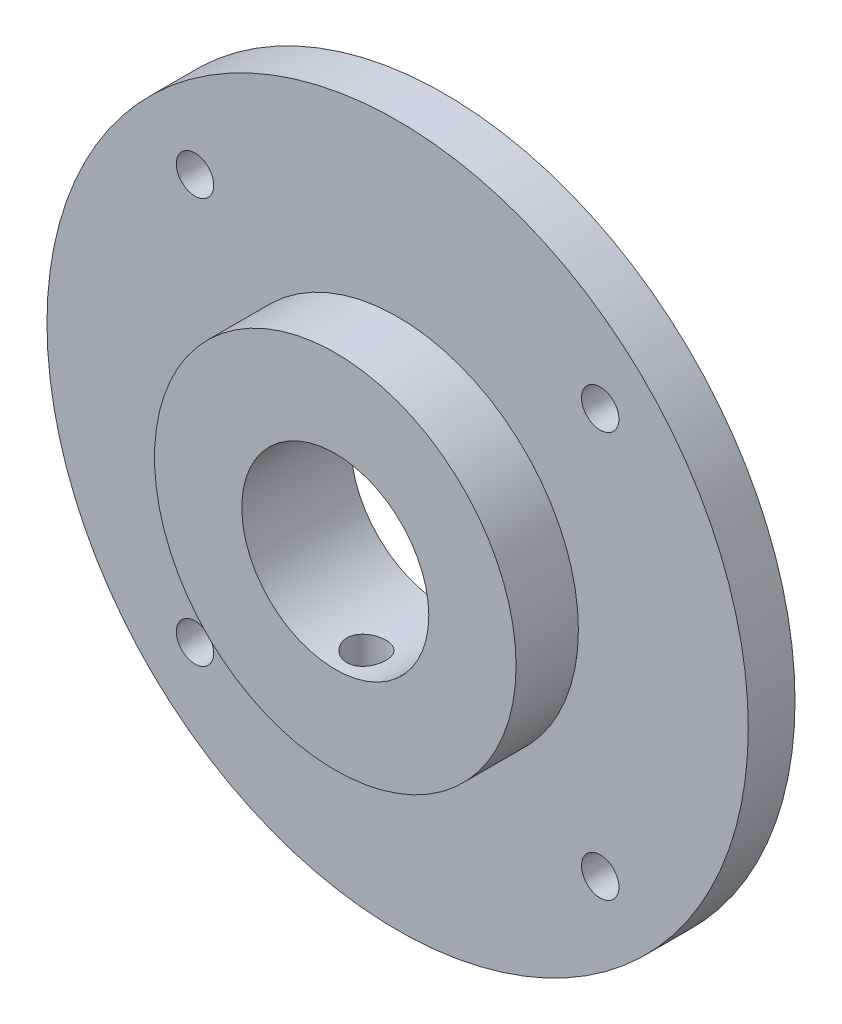
from build123d import *

# Parameters (mm, degrees)
SKETCH_1_R               = 22.5
SKETCH_1_R_2             = 6
SKETCH_1_R_3             = 1.2
EXTRUDE_1_DEPTH          = 3
SKETCH_3_R               = 11.6
SKETCH_3_R_2             = 7.6
EXTRUDE_2_DEPTH          = 4.2
CUT_EXTRUDE_START        = -0.2
SKETCH_4_R               = 11.6
CUT_EXTRUDE_1_DEPTH      = 0.2
SKETCH_5_R               = 7.6
SKETCH_5_R_2             = 6
EXTRUDE_3_DEPTH          = 4
CUT_EXTRUDE_2_DEPTH      = 10
CUT_EXTRUDE_2_DEPTH_BACK = 10


with BuildPart() as part:
    # 草图1 → 凸台-拉伸1 (new body)
    with BuildSketch(Plane.XY):
        with Locations((5.45, 10.5)):
            Circle(SKETCH_1_R)
        with Locations((5.45, 10.5)):
            Circle(SKETCH_1_R_2, mode=Mode.SUBTRACT)
        with Locations((-7.55, -2.5)):
            Circle(SKETCH_1_R_3, mode=Mode.SUBTRACT)
        with Locations((-7.55, 23.5)):
            Circle(SKETCH_1_R_3, mode=Mode.SUBTRACT)
        with Locations((18.45, 23.5)):
            Circle(SKETCH_1_R_3, mode=Mode.SUBTRACT)
        with Locations((18.45, -2.5)):
            Circle(SKETCH_1_R_3, mode=Mode.SUBTRACT)
    extrude(amount=EXTRUDE_1_DEPTH)

    # 草图3 → 凸台-拉伸2 (add)
    with BuildSketch(Plane.XY.offset(3)):
        with Locations((5.45, 10.5)):
            Circle(SKETCH_3_R)
        with Locations((5.45, 10.5)):
            Circle(SKETCH_3_R_2, mode=Mode.SUBTRACT)
    extrude(amount=EXTRUDE_2_DEPTH)

    # 草图4 → 切除-拉伸1 (cut)
    with BuildSketch(Plane.XY.offset(7.2).offset(CUT_EXTRUDE_START)):
        with Locations((5.45, 10.5)):
            Circle(SKETCH_4_R)
    extrude(amount=CUT_EXTRUDE_1_DEPTH, mode=Mode.SUBTRACT)

    # 草图5 → 凸台-拉伸3 (add)
    with BuildSketch(Plane.XY.offset(3)):
        with Locations((5.45, 10.5)):
            Circle(SKETCH_5_R)
        with Locations((5.45, 10.5)):
            Circle(SKETCH_5_R_2, mode=Mode.SUBTRACT)
    extrude(amount=EXTRUDE_3_DEPTH)

    # 草图6 → 切除-拉伸2 (cut, two sides: drawn at the far end of the back side and taken through both)
    with BuildSketch(Plane(origin=(0, 0, 0), x_dir=(1, 0, 0), z_dir=(0, 1, 0)).offset(-CUT_EXTRUDE_2_DEPTH_BACK)):
        with BuildLine():
            ThreePointArc((6.7, -5), (5.556579945, -3.754552002), (4.218174855, -4.787616354))
            Line((4.218174855, -4.787616354), (6.681825145, -5.212383646))
            ThreePointArc((6.681825145, -5.212383646), (6.695447998, -5.106579945), (6.7, -5))
        make_face()
        with BuildLine():
            Line((6.681825145, -5.212383646), (4.218174855, -4.787616354))
            ThreePointArc((4.218174855, -4.787616354), (5.237616354, -6.231825145), (6.681825145, -5.212383646))
        make_face()
    extrude(amount=CUT_EXTRUDE_2_DEPTH + CUT_EXTRUDE_2_DEPTH_BACK, mode=Mode.SUBTRACT)


solid = part.part
